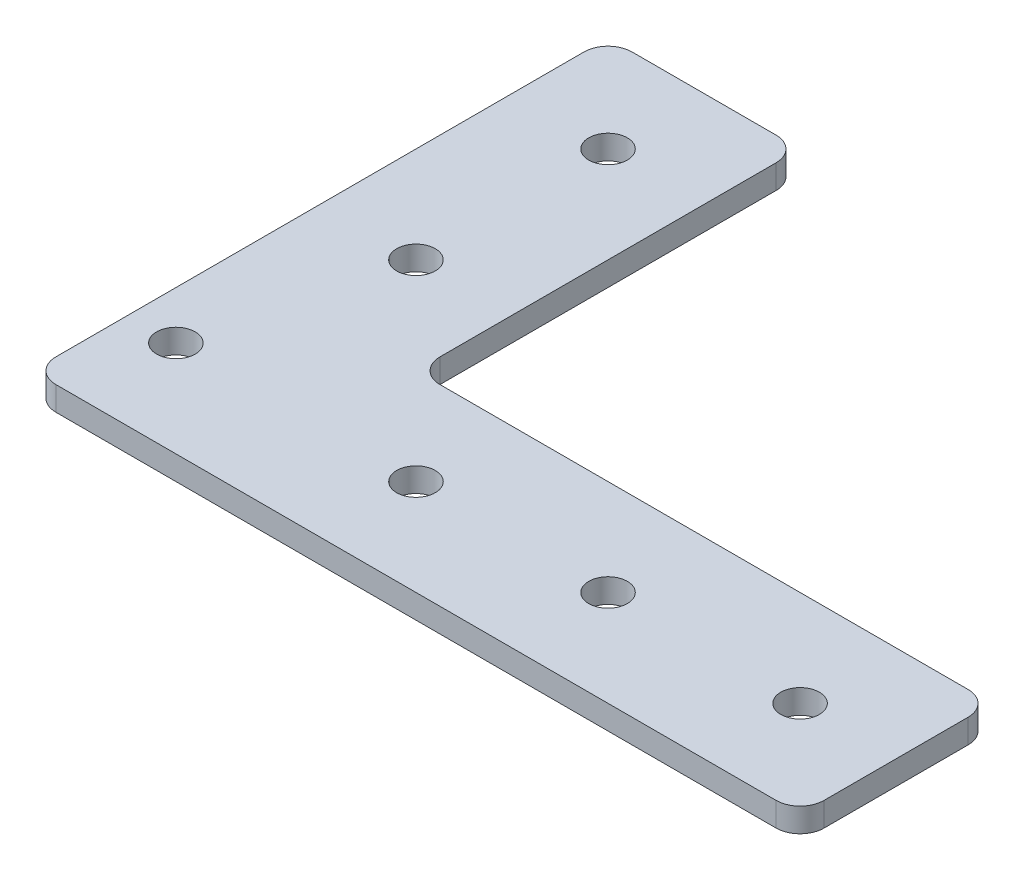
from build123d import *

# Parameters (mm, degrees)
BOSS_EXTRUDE1_DEPTH    = 3.175
F_10_CLEARANCE_HOLE1_D = 5.1054
F_10_CLEARANCE_HOLE4_D = 5.1054
CUT_EXTRUDE1_DEPTH     = 128.039681301
FILLET1_R              = 3.175


with BuildPart() as part:
    # Sketch1 → Boss-Extrude1 (new body)
    with BuildSketch(Plane(origin=(0, 0, 0), x_dir=(1, 0, 0), z_dir=(0, 1, 0))):
        Polygon((0, 0), (0, 76.2), (25.4, 76.2), (101.6, 25.4), (101.6, 0), align=None)
    extrude(amount=BOSS_EXTRUDE1_DEPTH)

    # #10 Clearance Hole1 (through all)
    with Locations(Plane(origin=(0, 3.175, 0), x_dir=(1, 0, 0), z_dir=(0, 1, 0))):
        with Locations((88.9, 12.7), (12.7, 63.5), (12.7, 38.1), (38.1, 12.7), (63.5, 12.7)):
            Hole(F_10_CLEARANCE_HOLE1_D / 2)

    # #10 Clearance Hole4 (through all)
    with Locations(Plane(origin=(0, 3.175, 0), x_dir=(1, 0, 0), z_dir=(0, 1, 0))):
        with Locations((6.35, 12.7)):
            Hole(F_10_CLEARANCE_HOLE4_D / 2)

    # Sketch6 → Cut-Extrude1 (cut, through all)
    with BuildSketch(Plane(origin=(0, 3.175, 0), x_dir=(1, 0, 0), z_dir=(0, 1, 0))):
        Polygon((25.4, 76.2), (25.4, 25.4), (101.6, 25.4), align=None)
    extrude(amount=-CUT_EXTRUDE1_DEPTH, mode=Mode.SUBTRACT)

    # Fillet1
    fillet1_edges = [part.edges().sort_by_distance(p)[0] for p in [
        (25.4, 1.5875, -25.4),
        (0, 1.5875, 0),
        (0, 1.5875, -76.2),
        (25.4, 1.5875, -76.2),
        (101.6, 1.5875, -25.4),
        (101.6, 1.5875, 0),
    ]]
    fillet(fillet1_edges, radius=FILLET1_R)


solid = part.part
